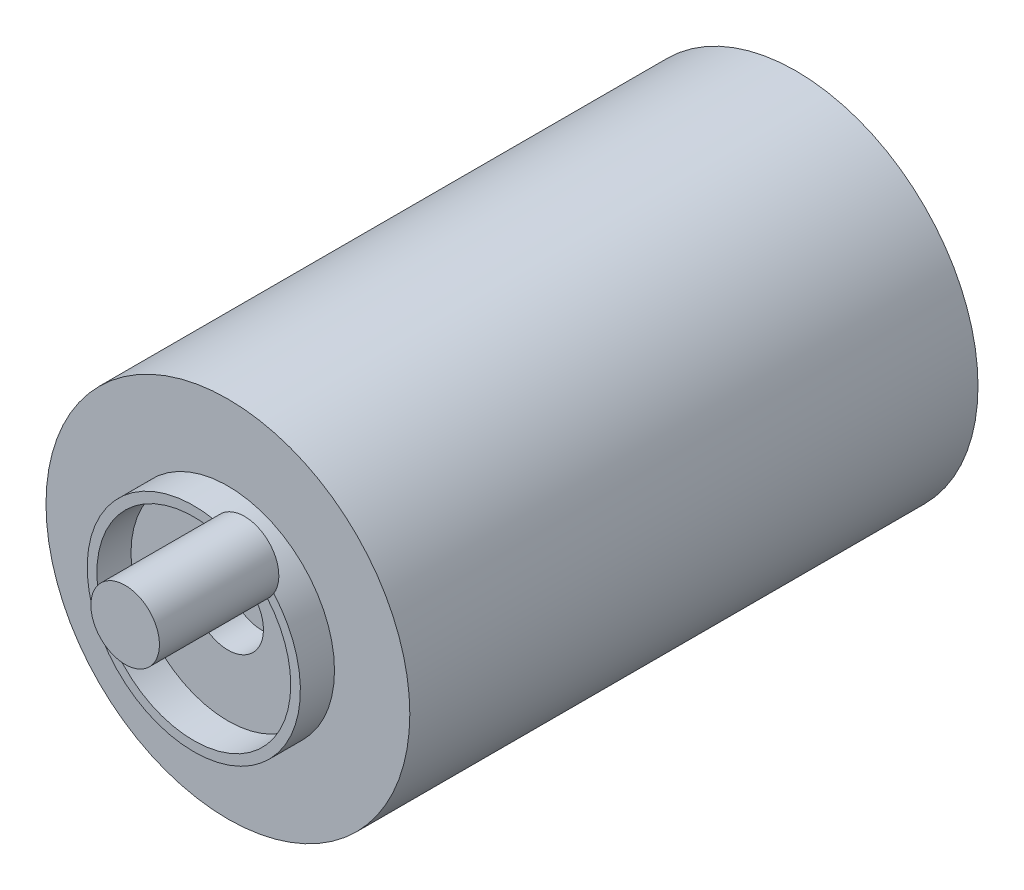
from build123d import *

# Parameters (mm, degrees)
BOSS_EXTRUDE1_DEPTH      = 10
BOSS_EXTRUDE1_DEPTH_BACK = 189.9
SKETCH1_R                = 64
SKETCH3_R                = 37.5
BOSS_EXTRUDE2_DEPTH      = 12
SKETCH4_R                = 34.103766087
CUT_EXTRUDE1_DEPTH       = 12
SKETCH5_R                = 12.5
CUT_EXTRUDE2_DEPTH       = 12
SKETCH11_R               = 12.062975476
BOSS_EXTRUDE5_DEPTH      = 42


with BuildPart() as part:
    # Sketch1 → Boss-Extrude1 (new, two sides: drawn at the far end of the back side and taken through both)
    with BuildSketch(Plane.XY.offset(-BOSS_EXTRUDE1_DEPTH_BACK)):
        Circle(SKETCH1_R)
    extrude(amount=BOSS_EXTRUDE1_DEPTH + BOSS_EXTRUDE1_DEPTH_BACK)

    # Sketch3 → Boss-Extrude2 (add)
    with BuildSketch(Plane.XY.offset(10)):
        Circle(SKETCH3_R)
    extrude(amount=BOSS_EXTRUDE2_DEPTH)

    # Sketch4 → Cut-Extrude1 (cut)
    with BuildSketch(Plane.XY.offset(22)):
        Circle(SKETCH4_R)
    extrude(amount=-CUT_EXTRUDE1_DEPTH, mode=Mode.SUBTRACT)

    # Sketch5 → Cut-Extrude2 (cut)
    with BuildSketch(Plane.XY.offset(10)):
        Circle(SKETCH5_R)
    extrude(amount=-CUT_EXTRUDE2_DEPTH, mode=Mode.SUBTRACT)

    # Sketch11 → Boss-Extrude5 (add)
    with BuildSketch(Plane.XY.offset(22)):
        with Locations(Location((17.84826857, 31.099255842, 0), (0, 0, 168.206932432))):
            Circle(SKETCH11_R)
    extrude(amount=BOSS_EXTRUDE5_DEPTH)


solid = part.part
